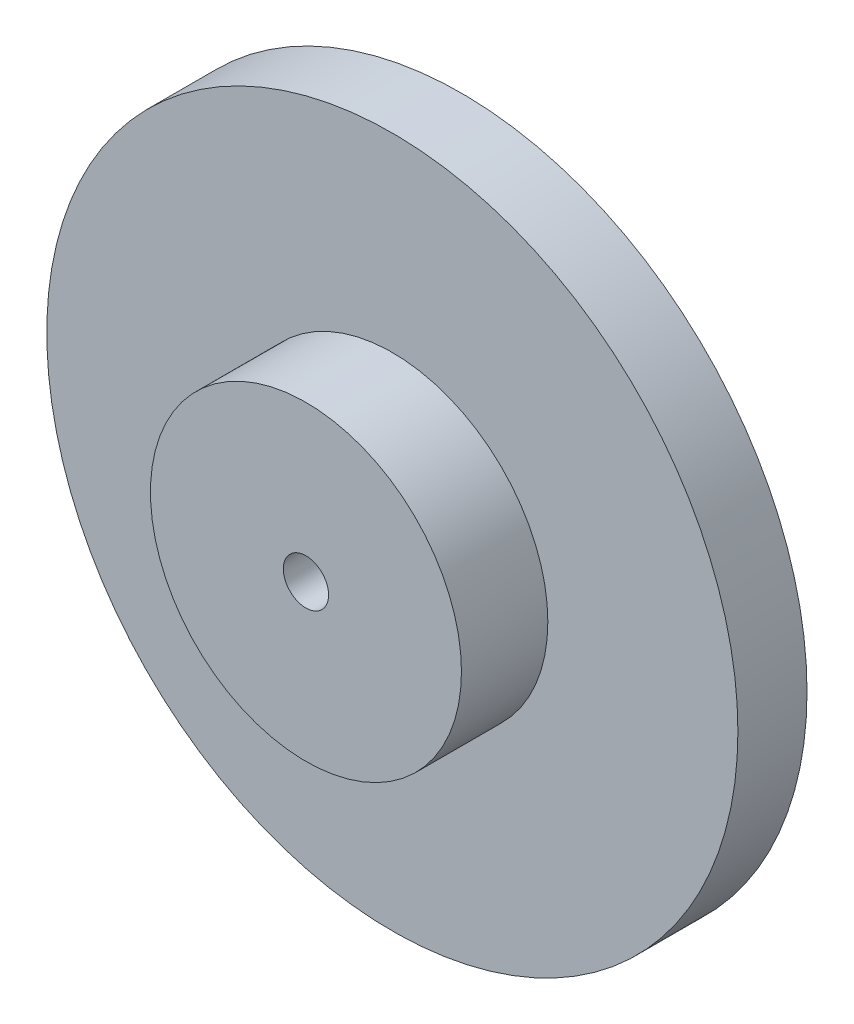
from build123d import *

# Parameters (mm, degrees)
SKETCH1_R           = 10
BOSS_EXTRUDE1_DEPTH = 2
SKETCH2_R           = 4.5
BOSS_EXTRUDE2_DEPTH = 2.5
SKETCH3_R           = 0.655025597
CUT_EXTRUDE1_DEPTH  = 15.5


with BuildPart() as part:
    # Sketch1 → Boss-Extrude1 (new body)
    with BuildSketch(Plane.XY):
        Circle(SKETCH1_R)
    extrude(amount=BOSS_EXTRUDE1_DEPTH)

    # Sketch2 → Boss-Extrude2 (add)
    with BuildSketch(Plane.XY.offset(2)):
        Circle(SKETCH2_R)
    extrude(amount=BOSS_EXTRUDE2_DEPTH)

    # Sketch3 → Cut-Extrude1 (cut)
    with BuildSketch(Plane.XY.offset(4.5)):
        Circle(SKETCH3_R)
    extrude(amount=-CUT_EXTRUDE1_DEPTH, mode=Mode.SUBTRACT)


solid = part.part
